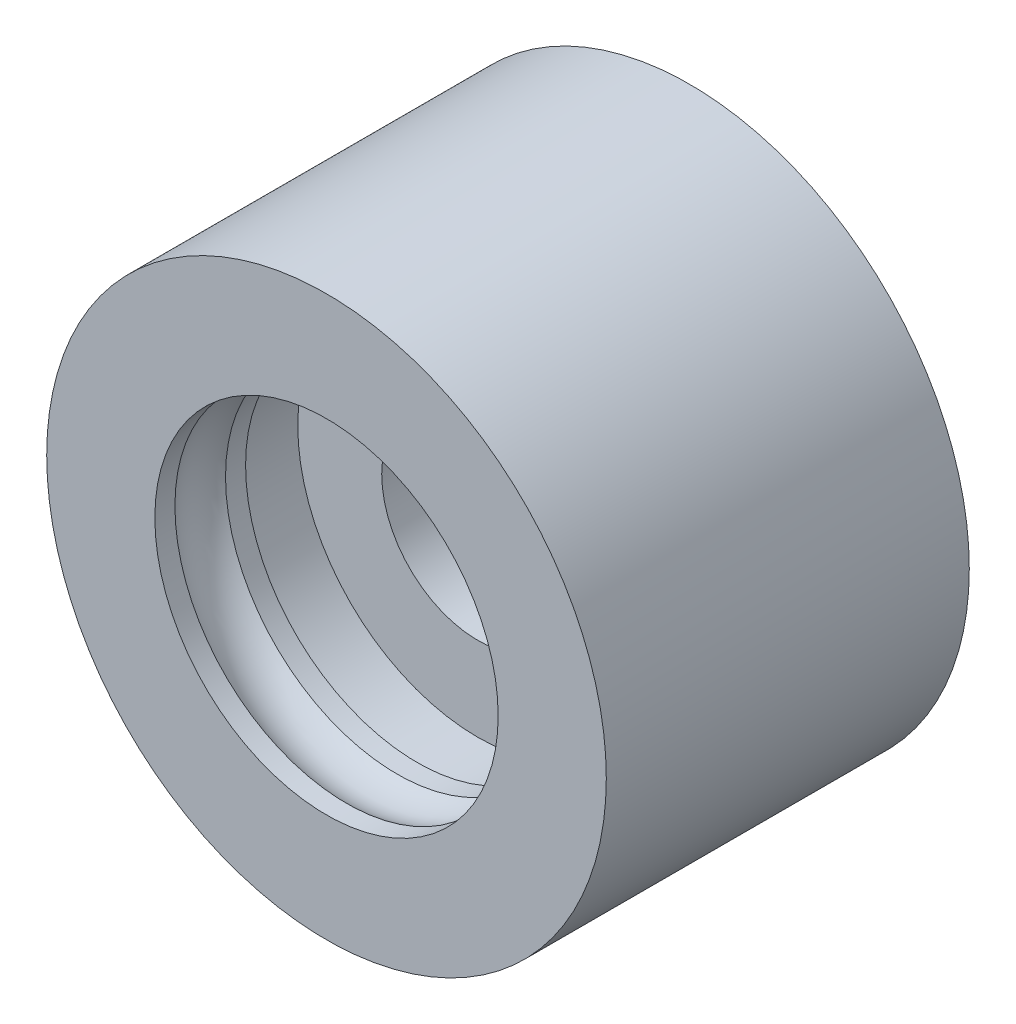
from build123d import *

# Parameters (mm, degrees)
SKETCH1_R           = 9.25
BOSS_EXTRUDE1_DEPTH = 12
SKETCH2_R           = 5.95
CUT_EXTRUDE1_DEPTH  = 4
CUT_EXTRUDE2_DEPTH  = 3
CIRPATTERN1_COUNT   = 8
SKETCH5_R           = 3.175
CUT_EXTRUDE3_DEPTH  = 8
CUT_EXTRUDE4_START  = -5
SKETCH6_R           = 5.95
CUT_EXTRUDE4_DEPTH  = 2
CUT_EXTRUDE5_REACH  = 19.752
SKETCH7_R           = 5.675
SKETCH8_R           = 1.5
FILLET1_R           = 1


with BuildPart() as part:
    # Sketch1 → Boss-Extrude1 (new body)
    with BuildSketch(Plane.XY):
        Circle(SKETCH1_R)
    extrude(amount=BOSS_EXTRUDE1_DEPTH)

    # Sketch2 → Cut-Extrude1 (cut)
    with BuildSketch(Plane(origin=(0, 0, 0), x_dir=(-1, 0, 0), z_dir=(0, 0, -1))):
        Circle(SKETCH2_R)
    extrude(amount=-CUT_EXTRUDE1_DEPTH, mode=Mode.SUBTRACT)

    # Sketch4 → Cut-Extrude2 (cut)
    with BuildSketch(Plane(origin=(0, 0, 0), x_dir=(-1, 0, 0), z_dir=(0, 0, -1))):
        with BuildLine():
            Line((1, 5.865364439), (1, 8.865364439))
            Line((1, 8.865364439), (-1, 8.865364439))
            Line((-1, 8.865364439), (-1, 5.865364439))
            ThreePointArc((-1, 5.865364439), (0, 5.95), (1, 5.865364439))
        make_face()
    cut_extrude2 = extrude(amount=-CUT_EXTRUDE2_DEPTH, mode=Mode.SUBTRACT)

    # CirPattern1: Cut-Extrude2 ×8 about axis
    cirpattern1_axis = Axis((0, 0, 0), (0, 0, 1))
    for i in range(1, CIRPATTERN1_COUNT):
        add(cut_extrude2.rotate(cirpattern1_axis, i * 360 / CIRPATTERN1_COUNT), mode=Mode.SUBTRACT)

    # Sketch5 → Cut-Extrude3 (cut)
    with BuildSketch(Plane.XY.offset(12)):
        Circle(SKETCH5_R)
    extrude(amount=-CUT_EXTRUDE3_DEPTH, mode=Mode.SUBTRACT)

    # Sketch6 → Cut-Extrude4 (cut)
    with BuildSketch(Plane.XY.offset(12).offset(CUT_EXTRUDE4_START)):
        with Locations(Location((0, 0, 0), (0, 0, 180))):
            Circle(SKETCH6_R)
    extrude(amount=CUT_EXTRUDE4_DEPTH, mode=Mode.SUBTRACT)

    # Sketch7 → Cut-Extrude5 (cut, up to next)
    with BuildSketch(Plane.XY.offset(12), mode=Mode.PRIVATE) as cut_extrude5_sk1:
        Circle(SKETCH7_R)
    cut_extrude5_tool1 = extrude(cut_extrude5_sk1.sketch, amount=-CUT_EXTRUDE5_REACH, mode=Mode.PRIVATE) & part.part
    add(cut_extrude5_tool1.solids().sort_by_distance((0, 0, 12))[0], mode=Mode.SUBTRACT)

    # Sketch8 → Cut-Revolve1 (revolve, cut)
    with BuildSketch(Plane(origin=(0, 0, 0), x_dir=(1, 0, 0), z_dir=(0, 1, 0)), mode=Mode.PRIVATE) as cut_revolve1_sk:
        with Locations((-4.43, -10.5)):
            Circle(SKETCH8_R)
    revolve(cut_revolve1_sk.sketch.rotate(Axis((0, 0, 0), (0, 0, 1)), 180), axis=Axis((0, 0, 0), (0, 0, 1)), mode=Mode.SUBTRACT)

    # Fillet1
    fillet1_edges = [part.edges().sort_by_distance(p)[0] for p in [
        (-1, 5.865364439, 1.5),
        (1, 5.865364439, 1.5),
        (-5.865364439, -1, 1.5),
        (-5.865364439, 1, 1.5),
        (-3.440332188, -4.85454575, 1.5),
        (-4.85454575, -3.440332188, 1.5),
        (1, -5.865364439, 1.5),
        (-1, -5.865364439, 1.5),
        (4.85454575, -3.440332188, 1.5),
        (3.440332188, -4.85454575, 1.5),
        (5.865364439, 1, 1.5),
        (5.865364439, -1, 1.5),
        (3.440332188, 4.85454575, 1.5),
        (4.85454575, 3.440332188, 1.5),
        (-4.85454575, 3.440332188, 1.5),
        (-3.440332188, 4.85454575, 1.5),
    ]]
    fillet(fillet1_edges, radius=FILLET1_R)


solid = part.part
